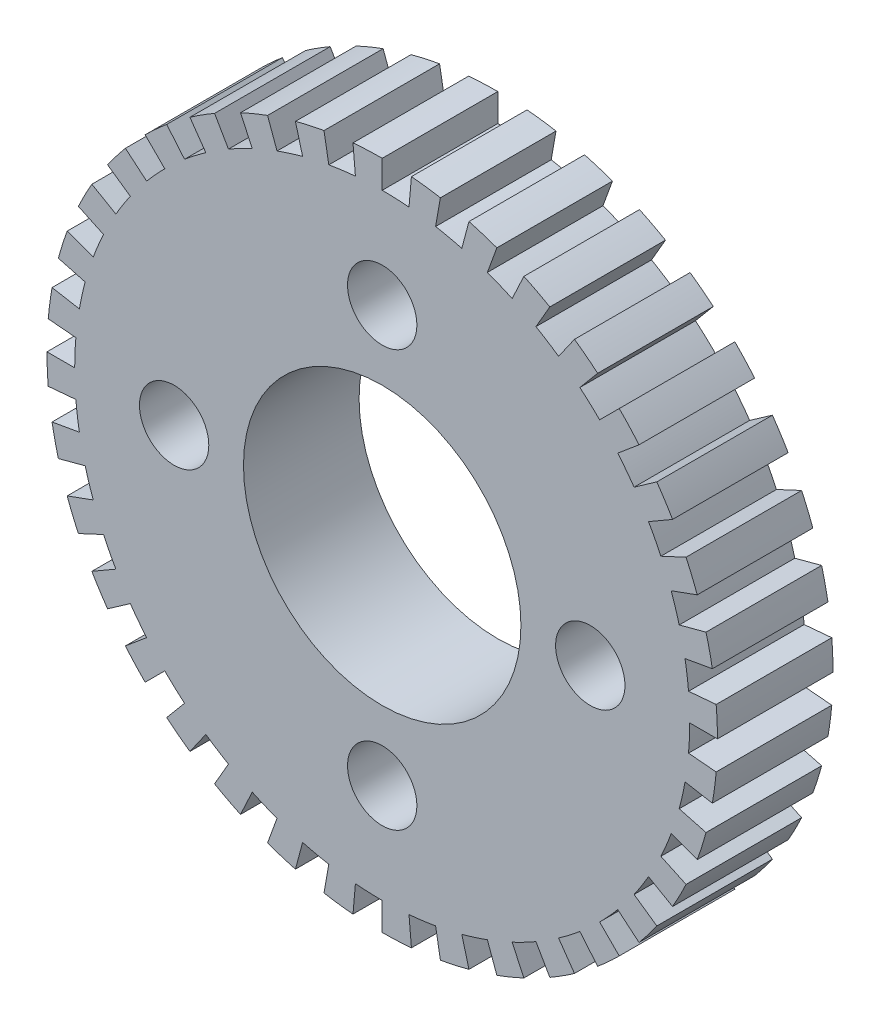
from build123d import *

# Parameters (mm, degrees)
SKETCH_1_R          = 12
EXTRUDE_1_DEPTH     = 10
SKETCH_2_R          = 3
CUT_EXTRUDE_1_DEPTH = 10


with BuildPart() as part:
    # 草图1 → 凸台-拉伸1 (new body)
    with BuildSketch(Plane.XY):
        with BuildLine():
            Line((26.19588623, -4.619041526), (28.559424837, -5.035797152))
            ThreePointArc((28.559424837, -5.035797152), (28.75190098, -3.785259574), (28.889646245, -2.52751654))
            Line((28.889646245, -2.52751654), (26.498778969, -2.318342757))
            ThreePointArc((26.498778969, -2.318342757), (26.574682694, -1.160275704), (26.6, 0))
            Line((26.6, 0), (29, 0))
            ThreePointArc((29, 0), (28.972398426, 1.264962234), (28.889646245, 2.52751654))
            Line((28.889646245, 2.52751654), (26.498778969, 2.318342757))
            ThreePointArc((26.498778969, 2.318342757), (26.372433313, 3.471996713), (26.19588623, 4.619041526))
            Line((26.19588623, 4.619041526), (28.559424837, 5.035797152))
            ThreePointArc((28.559424837, 5.035797152), (28.312584206, 6.276748804), (28.011848962, 7.505752308))
            Line((28.011848962, 7.505752308), (25.693626979, 6.8845866))
            ThreePointArc((25.693626979, 6.8845866), (25.36887089, 7.998774267), (24.995823713, 9.097735812))
            Line((24.995823713, 9.097735812), (27.251086003, 9.918584156))
            ThreePointArc((27.251086003, 9.918584156), (26.792506443, 11.097819539), (26.282925824, 12.25592959))
            Line((26.282925824, 12.25592959), (24.107787135, 11.241645762))
            ThreePointArc((24.107787135, 11.241645762), (23.594488163, 12.282513112), (23.036275741, 13.3))
            Line((23.036275741, 13.3), (25.11473671, 14.5))
            ThreePointArc((25.11473671, 14.5), (24.458351929, 15.581688642), (23.755409284, 16.633716654))
            Line((23.755409284, 16.633716654), (21.789444378, 15.257133207))
            ThreePointArc((21.789444378, 15.257133207), (21.103198852, 16.193054012), (20.376782187, 17.098150418))
            Line((20.376782187, 17.098150418), (22.21528885, 18.640840681))
            ThreePointArc((22.21528885, 18.640840681), (21.381042767, 19.592116021), (20.506096654, 20.506096654))
            Line((20.506096654, 20.506096654), (18.80904038, 18.80904038))
            ThreePointArc((18.80904038, 18.80904038), (17.970699523, 19.611577159), (17.098150418, 20.376782187))
            Line((17.098150418, 20.376782187), (18.640840681, 22.21528885))
            ThreePointArc((18.640840681, 22.21528885), (17.654081441, 23.007246868), (16.633716654, 23.755409284))
            Line((16.633716654, 23.755409284), (15.257133207, 21.789444378))
            ThreePointArc((15.257133207, 21.789444378), (14.292169582, 22.434212459), (13.3, 23.036275741))
            Line((13.3, 23.036275741), (14.5, 25.11473671))
            ThreePointArc((14.5, 25.11473671), (13.390709784, 25.723314162), (12.25592959, 26.282925824))
            Line((12.25592959, 26.282925824), (11.241645762, 24.107787135))
            ThreePointArc((11.241645762, 24.107787135), (10.179379301, 24.575195565), (9.097735812, 24.995823713))
            Line((9.097735812, 24.995823713), (9.918584156, 27.251086003))
            ThreePointArc((9.918584156, 27.251086003), (8.720468186, 27.657791572), (7.505752308, 28.011848962))
            Line((7.505752308, 28.011848962), (6.8845866, 25.693626979))
            ThreePointArc((6.8845866, 25.693626979), (5.757293731, 25.969473789), (4.619041526, 26.19588623))
            Line((4.619041526, 26.19588623), (5.035797152, 28.559424837))
            ThreePointArc((5.035797152, 28.559424837), (3.785259574, 28.75190098), (2.52751654, 28.889646245))
            Line((2.52751654, 28.889646245), (2.318342757, 26.498778969))
            ThreePointArc((2.318342757, 26.498778969), (1.160275704, 26.574682694), (0, 26.6))
            Line((0, 26.6), (0, 29))
            ThreePointArc((0, 29), (-1.264962234, 28.972398426), (-2.52751654, 28.889646245))
            Line((-2.52751654, 28.889646245), (-2.318342757, 26.498778969))
            ThreePointArc((-2.318342757, 26.498778969), (-3.471996713, 26.372433313), (-4.619041526, 26.19588623))
            Line((-4.619041526, 26.19588623), (-5.035797152, 28.559424837))
            ThreePointArc((-5.035797152, 28.559424837), (-6.276748804, 28.312584206), (-7.505752308, 28.011848962))
            Line((-7.505752308, 28.011848962), (-6.8845866, 25.693626979))
            ThreePointArc((-6.8845866, 25.693626979), (-7.998774267, 25.36887089), (-9.097735812, 24.995823713))
            Line((-9.097735812, 24.995823713), (-9.918584156, 27.251086003))
            ThreePointArc((-9.918584156, 27.251086003), (-11.097819539, 26.792506443), (-12.25592959, 26.282925824))
            Line((-12.25592959, 26.282925824), (-11.241645762, 24.107787135))
            ThreePointArc((-11.241645762, 24.107787135), (-12.282513112, 23.594488163), (-13.3, 23.036275741))
            Line((-13.3, 23.036275741), (-14.5, 25.11473671))
            ThreePointArc((-14.5, 25.11473671), (-15.581688642, 24.458351929), (-16.633716654, 23.755409284))
            Line((-16.633716654, 23.755409284), (-15.257133207, 21.789444378))
            ThreePointArc((-15.257133207, 21.789444378), (-16.193054012, 21.103198852), (-17.098150418, 20.376782187))
            Line((-17.098150418, 20.376782187), (-18.640840681, 22.21528885))
            ThreePointArc((-18.640840681, 22.21528885), (-19.592116021, 21.381042767), (-20.506096654, 20.506096654))
            Line((-20.506096654, 20.506096654), (-18.80904038, 18.80904038))
            ThreePointArc((-18.80904038, 18.80904038), (-19.611577159, 17.970699523), (-20.376782187, 17.098150418))
            Line((-20.376782187, 17.098150418), (-22.21528885, 18.640840681))
            ThreePointArc((-22.21528885, 18.640840681), (-23.007246868, 17.654081441), (-23.755409284, 16.633716654))
            Line((-23.755409284, 16.633716654), (-21.789444378, 15.257133207))
            ThreePointArc((-21.789444378, 15.257133207), (-22.434212459, 14.292169582), (-23.036275741, 13.3))
            Line((-23.036275741, 13.3), (-25.11473671, 14.5))
            ThreePointArc((-25.11473671, 14.5), (-25.723314162, 13.390709784), (-26.282925824, 12.25592959))
            Line((-26.282925824, 12.25592959), (-24.107787135, 11.241645762))
            ThreePointArc((-24.107787135, 11.241645762), (-24.575195565, 10.179379301), (-24.995823713, 9.097735812))
            Line((-24.995823713, 9.097735812), (-27.251086003, 9.918584156))
            ThreePointArc((-27.251086003, 9.918584156), (-27.657791572, 8.720468186), (-28.011848962, 7.505752308))
            Line((-28.011848962, 7.505752308), (-25.693626979, 6.8845866))
            ThreePointArc((-25.693626979, 6.8845866), (-25.969473789, 5.757293731), (-26.19588623, 4.619041526))
            Line((-26.19588623, 4.619041526), (-28.559424837, 5.035797152))
            ThreePointArc((-28.559424837, 5.035797152), (-28.75190098, 3.785259574), (-28.889646245, 2.52751654))
            Line((-28.889646245, 2.52751654), (-26.498778969, 2.318342757))
            ThreePointArc((-26.498778969, 2.318342757), (-26.574682694, 1.160275704), (-26.6, 0))
            Line((-26.6, 0), (-29, 0))
            ThreePointArc((-29, 0), (-28.972398426, -1.264962234), (-28.889646245, -2.52751654))
            Line((-28.889646245, -2.52751654), (-26.498778969, -2.318342757))
            ThreePointArc((-26.498778969, -2.318342757), (-26.372433313, -3.471996713), (-26.19588623, -4.619041526))
            Line((-26.19588623, -4.619041526), (-28.559424837, -5.035797152))
            ThreePointArc((-28.559424837, -5.035797152), (-28.312584206, -6.276748804), (-28.011848962, -7.505752308))
            Line((-28.011848962, -7.505752308), (-25.693626979, -6.8845866))
            ThreePointArc((-25.693626979, -6.8845866), (-25.36887089, -7.998774267), (-24.995823713, -9.097735812))
            Line((-24.995823713, -9.097735812), (-27.251086003, -9.918584156))
            ThreePointArc((-27.251086003, -9.918584156), (-26.792506443, -11.097819539), (-26.282925824, -12.25592959))
            Line((-26.282925824, -12.25592959), (-24.107787135, -11.241645762))
            ThreePointArc((-24.107787135, -11.241645762), (-23.594488163, -12.282513112), (-23.036275741, -13.3))
            Line((-23.036275741, -13.3), (-25.11473671, -14.5))
            ThreePointArc((-25.11473671, -14.5), (-24.458351929, -15.581688642), (-23.755409284, -16.633716654))
            Line((-23.755409284, -16.633716654), (-21.789444378, -15.257133207))
            ThreePointArc((-21.789444378, -15.257133207), (-21.103198852, -16.193054012), (-20.376782187, -17.098150418))
            Line((-20.376782187, -17.098150418), (-22.21528885, -18.640840681))
            ThreePointArc((-22.21528885, -18.640840681), (-21.381042767, -19.592116021), (-20.506096654, -20.506096654))
            Line((-20.506096654, -20.506096654), (-18.80904038, -18.80904038))
            ThreePointArc((-18.80904038, -18.80904038), (-17.970699523, -19.611577159), (-17.098150418, -20.376782187))
            Line((-17.098150418, -20.376782187), (-18.640840681, -22.21528885))
            ThreePointArc((-18.640840681, -22.21528885), (-17.654081441, -23.007246868), (-16.633716654, -23.755409284))
            Line((-16.633716654, -23.755409284), (-15.257133207, -21.789444378))
            ThreePointArc((-15.257133207, -21.789444378), (-14.292169582, -22.434212459), (-13.3, -23.036275741))
            Line((-13.3, -23.036275741), (-14.5, -25.11473671))
            ThreePointArc((-14.5, -25.11473671), (-13.390709784, -25.723314162), (-12.25592959, -26.282925824))
            Line((-12.25592959, -26.282925824), (-11.241645762, -24.107787135))
            ThreePointArc((-11.241645762, -24.107787135), (-10.179379301, -24.575195565), (-9.097735812, -24.995823713))
            Line((-9.097735812, -24.995823713), (-9.918584156, -27.251086003))
            ThreePointArc((-9.918584156, -27.251086003), (-8.720468186, -27.657791572), (-7.505752308, -28.011848962))
            Line((-7.505752308, -28.011848962), (-6.8845866, -25.693626979))
            ThreePointArc((-6.8845866, -25.693626979), (-5.757293731, -25.969473789), (-4.619041526, -26.19588623))
            Line((-4.619041526, -26.19588623), (-5.035797152, -28.559424837))
            ThreePointArc((-5.035797152, -28.559424837), (-3.785259574, -28.75190098), (-2.52751654, -28.889646245))
            Line((-2.52751654, -28.889646245), (-2.318342757, -26.498778969))
            ThreePointArc((-2.318342757, -26.498778969), (-1.160275704, -26.574682694), (0, -26.6))
            Line((0, -26.6), (0, -29))
            ThreePointArc((0, -29), (1.264962234, -28.972398426), (2.52751654, -28.889646245))
            Line((2.52751654, -28.889646245), (2.318342757, -26.498778969))
            ThreePointArc((2.318342757, -26.498778969), (3.471996713, -26.372433313), (4.619041526, -26.19588623))
            Line((4.619041526, -26.19588623), (5.035797152, -28.559424837))
            ThreePointArc((5.035797152, -28.559424837), (6.276748804, -28.312584206), (7.505752308, -28.011848962))
            Line((7.505752308, -28.011848962), (6.8845866, -25.693626979))
            ThreePointArc((6.8845866, -25.693626979), (7.998774267, -25.36887089), (9.097735812, -24.995823713))
            Line((9.097735812, -24.995823713), (9.918584156, -27.251086003))
            ThreePointArc((9.918584156, -27.251086003), (11.097819539, -26.792506443), (12.25592959, -26.282925824))
            Line((12.25592959, -26.282925824), (11.241645762, -24.107787135))
            ThreePointArc((11.241645762, -24.107787135), (12.282513112, -23.594488163), (13.3, -23.036275741))
            Line((13.3, -23.036275741), (14.5, -25.11473671))
            ThreePointArc((14.5, -25.11473671), (15.581688642, -24.458351929), (16.633716654, -23.755409284))
            Line((16.633716654, -23.755409284), (15.257133207, -21.789444378))
            ThreePointArc((15.257133207, -21.789444378), (16.193054012, -21.103198852), (17.098150418, -20.376782187))
            Line((17.098150418, -20.376782187), (18.640840681, -22.21528885))
            ThreePointArc((18.640840681, -22.21528885), (19.592116021, -21.381042767), (20.506096654, -20.506096654))
            Line((20.506096654, -20.506096654), (18.80904038, -18.80904038))
            ThreePointArc((18.80904038, -18.80904038), (19.611577159, -17.970699523), (20.376782187, -17.098150418))
            Line((20.376782187, -17.098150418), (22.21528885, -18.640840681))
            ThreePointArc((22.21528885, -18.640840681), (23.007246868, -17.654081441), (23.755409284, -16.633716654))
            Line((23.755409284, -16.633716654), (21.789444378, -15.257133207))
            ThreePointArc((21.789444378, -15.257133207), (22.434212459, -14.292169582), (23.036275741, -13.3))
            Line((23.036275741, -13.3), (25.11473671, -14.5))
            ThreePointArc((25.11473671, -14.5), (25.723314162, -13.390709784), (26.282925824, -12.25592959))
            Line((26.282925824, -12.25592959), (24.107787135, -11.241645762))
            ThreePointArc((24.107787135, -11.241645762), (24.575195565, -10.179379301), (24.995823713, -9.097735812))
            Line((24.995823713, -9.097735812), (27.251086003, -9.918584156))
            ThreePointArc((27.251086003, -9.918584156), (27.657791572, -8.720468186), (28.011848962, -7.505752308))
            Line((28.011848962, -7.505752308), (25.693626979, -6.8845866))
            ThreePointArc((25.693626979, -6.8845866), (25.969473789, -5.757293731), (26.19588623, -4.619041526))
        make_face()
        Circle(SKETCH_1_R, mode=Mode.SUBTRACT)
    extrude(amount=EXTRUDE_1_DEPTH)

    # 草图2 → 切除-拉伸1 (cut)
    with BuildSketch(Plane.XY):
        with Locations((18, 0)):
            Circle(SKETCH_2_R)
        with Locations((0, -18)):
            Circle(SKETCH_2_R)
        with Locations((-18, 0)):
            Circle(SKETCH_2_R)
        with Locations((0, 18)):
            Circle(SKETCH_2_R)
    extrude(amount=CUT_EXTRUDE_1_DEPTH, mode=Mode.SUBTRACT)


solid = part.part
